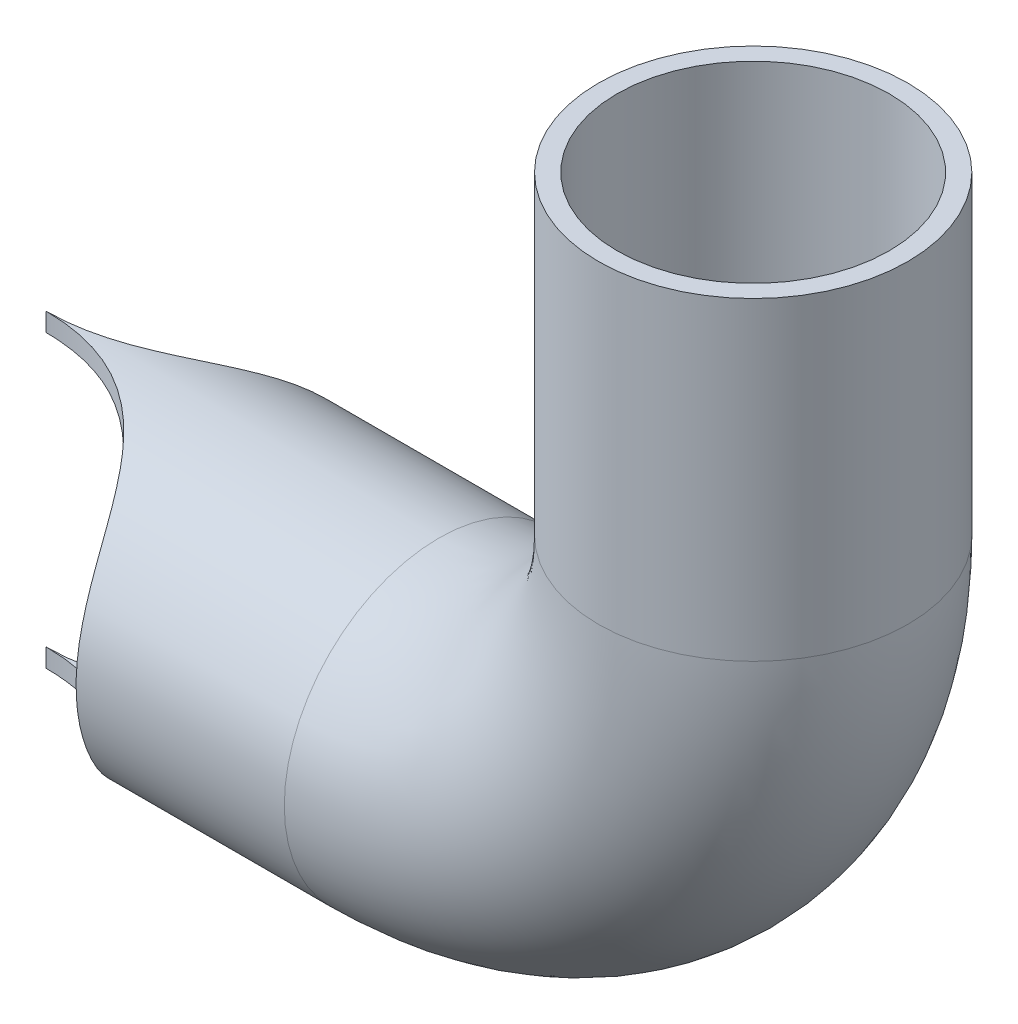
from build123d import *

# Parameters (mm, degrees)
SKETCH1_R          = 12.5
SKETCH3_R          = 11
SKETCH7_R          = 15.157577
CUT_EXTRUDE1_DEPTH = 81.367795269


with BuildPart() as part:
    # Sweep1: sweep along a path in Sketch2
    with BuildLine(Plane.XY) as sweep1_path:
        Line((0, 0), (31.75, 0))
        ThreePointArc((31.75, 0), (49.710512242, 7.439487758), (57.15, 25.4))
        Line((57.15, 25.4), (57.15, 50.8))
    # Sketch1 → Sweep1 (sweep)
    with BuildSketch(Plane(origin=(0, 0, 0), x_dir=(0, 0, -1), z_dir=(1, 0, 0))):
        Circle(SKETCH1_R)
    sweep(path=sweep1_path.line)

    # Cut-Sweep1: sweep along a path in Sketch2<2>
    with BuildLine(Plane.XY) as cut_sweep1_path:
        Line((0, 0), (31.75, 0))
        ThreePointArc((31.75, 0), (49.710512242, 7.439487758), (57.15, 25.4))
        Line((57.15, 25.4), (57.15, 50.8))
    # Sketch3 → Cut-Sweep1 (sweep, cut)
    with BuildSketch(Plane.ZY):
        Circle(SKETCH3_R)
    sweep(path=cut_sweep1_path.line, mode=Mode.SUBTRACT)

    # Sketch7 → Cut-Extrude1 (cut, through all)
    with BuildSketch(Plane(origin=(0, 12.7, 0), x_dir=(1, 0, 0), z_dir=(0, 1, 0))):
        with Locations((0, 15.157577)):
            Circle(SKETCH7_R)
    cut_extrude1 = extrude(amount=-CUT_EXTRUDE1_DEPTH, mode=Mode.SUBTRACT)

    # Mirror1: Cut-Extrude1 across plane
    add(cut_extrude1.mirror(Plane.XY), mode=Mode.SUBTRACT)


solid = part.part
